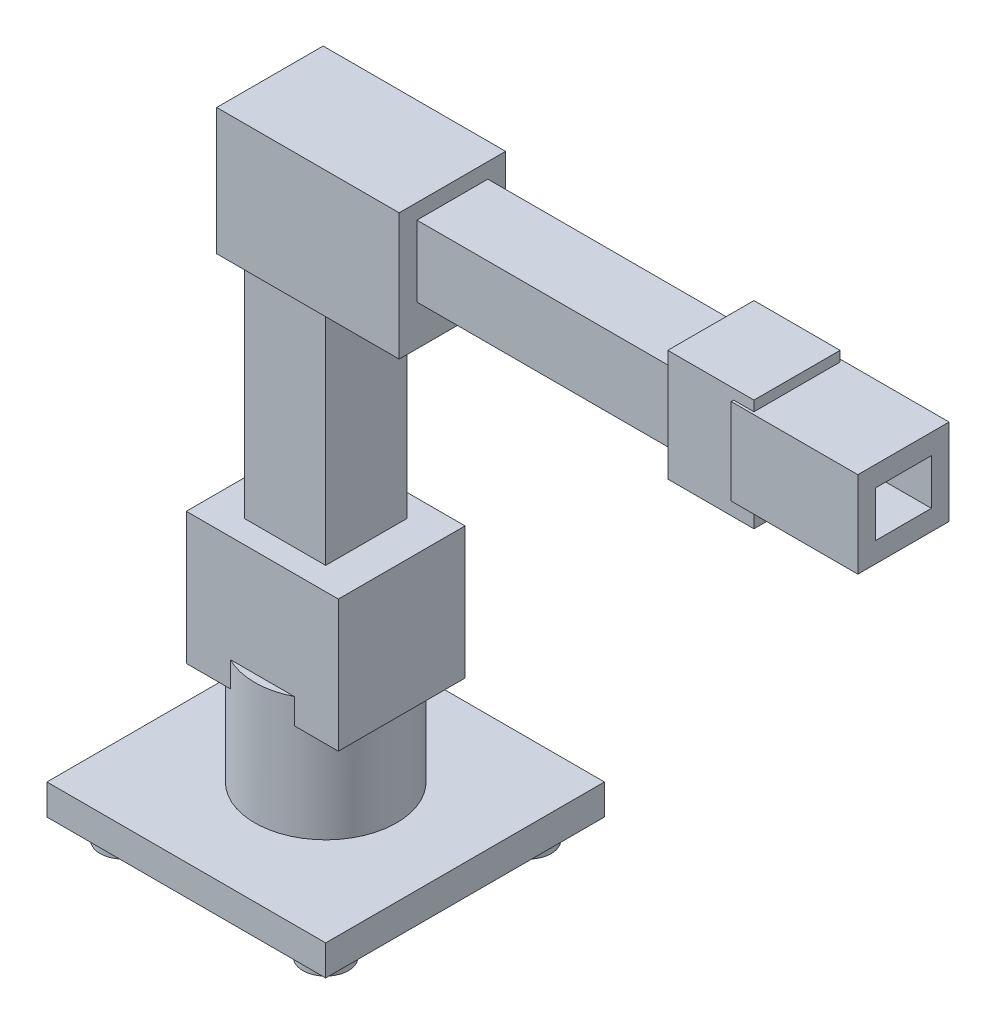
from build123d import *

# Parameters (mm, degrees)
SKETCH1_W            = 110
SKETCH1_H            = 110
BOSS_EXTRUDE1_DEPTH  = 12
SKETCH2_R            = 9
BOSS_EXTRUDE2_DEPTH  = 8
SKETCH3_R            = 28
BOSS_EXTRUDE3_DEPTH  = 60
SKETCH4_W            = 60
SKETCH4_H            = 52
BOSS_EXTRUDE4_DEPTH  = 25
SKETCH5_W            = 32
SKETCH5_H            = 107
BOSS_EXTRUDE5_DEPTH  = 16
SKETCH6_W            = 72
SKETCH6_H            = 50
BOSS_EXTRUDE6_DEPTH  = 21
SKETCH7_R            = 18
BOSS_EXTRUDE7_DEPTH  = 6
SKETCH8_W            = 115
SKETCH8_H            = 28
BOSS_EXTRUDE8_DEPTH  = 14
SKETCH9_W            = 34
SKETCH9_H            = 44
BOSS_EXTRUDE9_DEPTH  = 17
SKETCH10_R           = 13
BOSS_EXTRUDE10_DEPTH = 15
SKETCH11_W           = 50
SKETCH11_H           = 34
BOSS_EXTRUDE11_DEPTH = 18
SKETCH12_W           = 36
SKETCH12_H           = 18
CUT_EXTRUDE1_DEPTH   = 11
SKETCH13_R           = 6
CUT_EXTRUDE2_DEPTH   = 339.444973371
SKETCH14_R           = 5
CUT_EXTRUDE3_DEPTH   = 339.444973371
SKETCH15_R           = 4
CUT_EXTRUDE4_DEPTH   = 339.444973371
SKETCH16_R           = 3.5
CUT_EXTRUDE5_DEPTH   = 339.444973371


with BuildPart() as part:
    # Sketch1 → Boss-Extrude1 (new body)
    with BuildSketch(Plane(origin=(0, 0, 0), x_dir=(1, 0, 0), z_dir=(0, 1, 0))):
        Rectangle(SKETCH1_W, SKETCH1_H)
    extrude(amount=BOSS_EXTRUDE1_DEPTH)

    # Sketch2 → Boss-Extrude2 (add)
    with BuildSketch(Plane(origin=(0, 0, 0), x_dir=(1, 0, 0), z_dir=(0, 1, 0))):
        with Locations(Location((-40, -40, 0), (0, 0, 270))):
            Circle(SKETCH2_R)
        with Locations(Location((40, -40, 0), (0, 0, 270))):
            Circle(SKETCH2_R)
        with Locations(Location((-40, 40, 0), (0, 0, 270))):
            Circle(SKETCH2_R)
        with Locations(Location((40, 40, 0), (0, 0, 270))):
            Circle(SKETCH2_R)
    extrude(amount=-BOSS_EXTRUDE2_DEPTH)

    # Sketch3 → Boss-Extrude3 (add)
    with BuildSketch(Plane(origin=(0, 0, 0), x_dir=(1, 0, 0), z_dir=(0, 1, 0))):
        with Locations(Location((0, 0, 0), (0, 0, 90))):
            Circle(SKETCH3_R)
    extrude(amount=BOSS_EXTRUDE3_DEPTH)

    # Sketch4 → Boss-Extrude4 (add, symmetric)
    with BuildSketch(Plane.XY):
        with Locations((0, 76)):
            Rectangle(SKETCH4_W, SKETCH4_H)
    extrude(amount=BOSS_EXTRUDE4_DEPTH, both=True)

    # Sketch5 → Boss-Extrude5 (add, symmetric)
    with BuildSketch(Plane.XY):
        with Locations((0, 151.5)):
            Rectangle(SKETCH5_W, SKETCH5_H)
    extrude(amount=BOSS_EXTRUDE5_DEPTH, both=True)

    # Sketch6 → Boss-Extrude6 (add, symmetric)
    with BuildSketch(Plane.XY):
        with Locations((14, 217)):
            Rectangle(SKETCH6_W, SKETCH6_H)
    extrude(amount=BOSS_EXTRUDE6_DEPTH, both=True)

    # Sketch7 → Boss-Extrude7 (add, symmetric)
    with BuildSketch(Plane.XY):
        with Locations((14, 217)):
            Circle(SKETCH7_R)
    extrude(amount=BOSS_EXTRUDE7_DEPTH, both=True)

    # Sketch8 → Boss-Extrude8 (add, symmetric)
    with BuildSketch(Plane.XY):
        with Locations((102.5, 222)):
            Rectangle(SKETCH8_W, SKETCH8_H)
    extrude(amount=BOSS_EXTRUDE8_DEPTH, both=True)

    # Sketch9 → Boss-Extrude9 (add, symmetric)
    with BuildSketch(Plane.XY):
        with Locations((169, 222)):
            Rectangle(SKETCH9_W, SKETCH9_H)
    extrude(amount=BOSS_EXTRUDE9_DEPTH, both=True)

    # Sketch10 → Boss-Extrude10 (add, symmetric)
    with BuildSketch(Plane.XY):
        with Locations((186, 222)):
            Circle(SKETCH10_R)
    extrude(amount=BOSS_EXTRUDE10_DEPTH, both=True)

    # Sketch11 → Boss-Extrude11 (add, symmetric)
    with BuildSketch(Plane.XY):
        with Locations((203, 223)):
            Rectangle(SKETCH11_W, SKETCH11_H)
    extrude(amount=BOSS_EXTRUDE11_DEPTH, both=True)

    # Sketch12 → Cut-Extrude1 (cut, symmetric)
    with BuildSketch(Plane.XY):
        with Locations((214, 223)):
            Rectangle(SKETCH12_W, SKETCH12_H)
    extrude(amount=CUT_EXTRUDE1_DEPTH, both=True, mode=Mode.SUBTRACT)

    # Sketch13 → Cut-Extrude2 (cut, through all)
    with BuildSketch(Plane(origin=(0, 0, 0), x_dir=(0, 0, -1), z_dir=(1, 0, 0))):
        with Locations((0, 76)):
            Circle(SKETCH13_R)
    extrude(amount=-CUT_EXTRUDE2_DEPTH, mode=Mode.SUBTRACT)

    # Sketch14 → Cut-Extrude3 (cut, through all)
    with BuildSketch(Plane.XY):
        with Locations((14, 217)):
            Circle(SKETCH14_R)
    extrude(amount=-CUT_EXTRUDE3_DEPTH, mode=Mode.SUBTRACT)

    # Sketch15 → Cut-Extrude4 (cut, through all)
    with BuildSketch(Plane.XY):
        with Locations((169, 222)):
            Circle(SKETCH15_R)
    extrude(amount=-CUT_EXTRUDE4_DEPTH, mode=Mode.SUBTRACT)

    # Sketch16 → Cut-Extrude5 (cut, through all)
    with BuildSketch(Plane(origin=(0, 0, 0), x_dir=(1, 0, 0), z_dir=(0, 1, 0))):
        with Locations(Location((-42, -42, 0), (0, 0, 270))):
            Circle(SKETCH16_R)
        with Locations(Location((42, -42, 0), (0, 0, 270))):
            Circle(SKETCH16_R)
        with Locations(Location((-42, 42, 0), (0, 0, 270))):
            Circle(SKETCH16_R)
        with Locations(Location((42, 42, 0), (0, 0, 270))):
            Circle(SKETCH16_R)
    extrude(amount=-CUT_EXTRUDE5_DEPTH, mode=Mode.SUBTRACT)


solid = part.part
